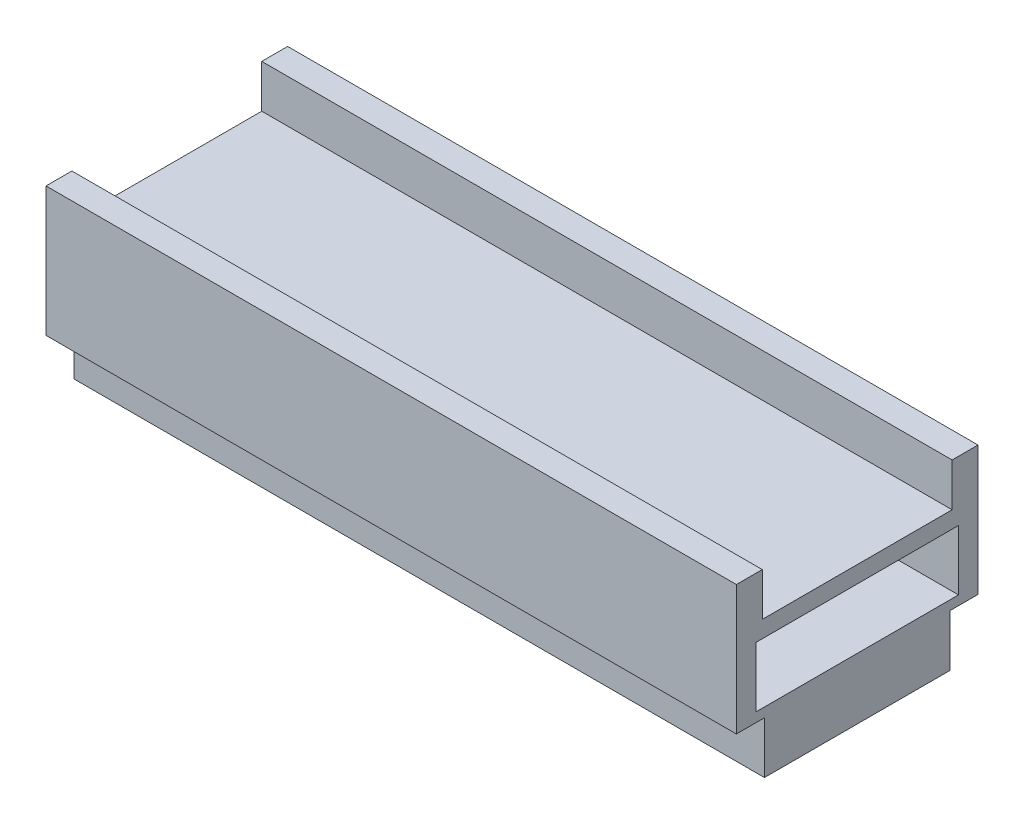
from build123d import *

# Parameters (mm, degrees)
SKETCH1_W           = 80
SKETCH1_H           = 21.5
BOSS_EXTRUDE1_DEPTH = 6
SKETCH2_W           = 80
SKETCH2_H           = 28
BOSS_EXTRUDE2_DEPTH = 15
SKETCH3_W           = 80
SKETCH3_H           = 22
CUT_EXTRUDE1_DEPTH  = 5
CUT_EXTRUDE2_REACH  = 85.887
SKETCH4_W           = 23.48673248
SKETCH4_H           = 6.968727305


with BuildPart() as part:
    # Sketch1 → Boss-Extrude1 (new body)
    with BuildSketch(Plane(origin=(0, 0, 0), x_dir=(1, 0, 0), z_dir=(0, 1, 0))):
        Rectangle(SKETCH1_W, SKETCH1_H)
    extrude(amount=BOSS_EXTRUDE1_DEPTH)

    # Sketch2 → Boss-Extrude2 (add)
    with BuildSketch(Plane(origin=(0, 6, 0), x_dir=(1, 0, 0), z_dir=(0, 1, 0))):
        Rectangle(SKETCH2_W, SKETCH2_H)
    extrude(amount=BOSS_EXTRUDE2_DEPTH)

    # Sketch3 → Cut-Extrude1 (cut)
    with BuildSketch(Plane(origin=(0, 21, 0), x_dir=(1, 0, 0), z_dir=(0, 1, 0))):
        Rectangle(SKETCH3_W, SKETCH3_H)
    extrude(amount=-CUT_EXTRUDE1_DEPTH, mode=Mode.SUBTRACT)

    # Sketch4 → Cut-Extrude2 (cut, up to next)
    with BuildSketch(Plane(origin=(40, 0, 0), x_dir=(0, 0, -1), z_dir=(1, 0, 0)), mode=Mode.PRIVATE) as cut_extrude2_sk1:
        with Locations((0, 10.569687274)):
            Rectangle(SKETCH4_W, SKETCH4_H)
    cut_extrude2_tool1 = extrude(cut_extrude2_sk1.sketch, amount=-CUT_EXTRUDE2_REACH, mode=Mode.PRIVATE) & part.part
    add(cut_extrude2_tool1.solids().sort_by_distance((40, 10.569687, 0))[0], mode=Mode.SUBTRACT)


solid = part.part
